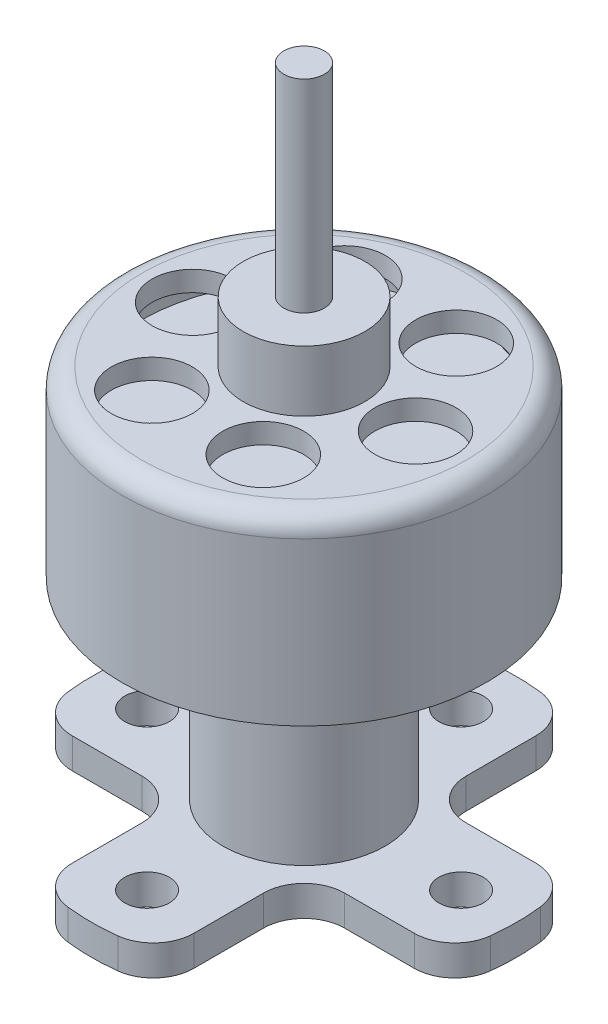
from build123d import *

# Parameters (mm, degrees)
BOSS_EXTRUDE1_DEPTH = 1.5
SKETCH2_R           = 1.1
CUT_EXTRUDE1_DEPTH  = 15.924811557
FILLET1_R           = 2
SKETCH3_R           = 4
BOSS_EXTRUDE2_DEPTH = 9.5
SKETCH4_R           = 9
BOSS_EXTRUDE3_DEPTH = 9
FILLET2_R           = 1
SKETCH5_R           = 3
BOSS_EXTRUDE4_DEPTH = 3
SKETCH6_R           = 1
BOSS_EXTRUDE5_DEPTH = 10
SKETCH7_R           = 2
CUT_EXTRUDE2_DEPTH  = 1
SKETCH8_R           = 8
CUT_EXTRUDE3_DEPTH  = 1


with BuildPart() as part:
    # Sketch1 → Boss-Extrude1 (new body)
    with BuildSketch(Plane(origin=(0, 0, 0), x_dir=(1, 0, 0), z_dir=(0, 1, 0))):
        with BuildLine():
            Line((-3, 10.062305899), (-3, 3))
            Line((-3, 3), (-10.062305899, 3))
            ThreePointArc((-10.062305899, 3), (-10.5, 0), (-10.062305899, -3))
            Line((-10.062305899, -3), (-3, -3))
            Line((-3, -3), (-3, -10.062305899))
            ThreePointArc((-3, -10.062305899), (0, -10.5), (3, -10.062305899))
            Line((3, -10.062305899), (3, -3))
            Line((3, -3), (10.062305899, -3))
            ThreePointArc((10.062305899, -3), (10.5, 0), (10.062305899, 3))
            Line((10.062305899, 3), (3, 3))
            Line((3, 3), (3, 10.062305899))
            ThreePointArc((3, 10.062305899), (0, 10.5), (-3, 10.062305899))
        make_face()
    extrude(amount=BOSS_EXTRUDE1_DEPTH)

    # Sketch2 → Cut-Extrude1 (cut, through all)
    with BuildSketch(Plane(origin=(0, 1.5, 0), x_dir=(1, 0, 0), z_dir=(0, 1, 0))):
        with Locations(Location((-7.75, 0, 0), (0, 0, 270))):
            Circle(SKETCH2_R)
        with Locations(Location((0, 7.75, 0), (0, 0, 270))):
            Circle(SKETCH2_R)
        with Locations(Location((7.75, 0, 0), (0, 0, 270))):
            Circle(SKETCH2_R)
        with Locations(Location((0, -7.75, 0), (0, 0, 270))):
            Circle(SKETCH2_R)
    extrude(amount=-CUT_EXTRUDE1_DEPTH, mode=Mode.SUBTRACT)

    # Fillet1
    fillet1_edges = [part.edges().sort_by_distance(p)[0] for p in [
        (3, 0.75, 3),
        (3, 0.75, 10.062305899),
        (-3, 0.75, 10.062305899),
        (-3, 0.75, 3),
        (-10.062305899, 0.75, 3),
        (-10.062305899, 0.75, -3),
        (-3, 0.75, -3),
        (-3, 0.75, -10.062305899),
        (3, 0.75, -10.062305899),
        (3, 0.75, -3),
        (10.062305899, 0.75, -3),
        (10.062305899, 0.75, 3),
    ]]
    fillet(fillet1_edges, radius=FILLET1_R)

    # Sketch3 → Boss-Extrude2 (add)
    with BuildSketch(Plane(origin=(0, 1.5, 0), x_dir=(1, 0, 0), z_dir=(0, 1, 0))):
        with Locations(Location((0, 0, 0), (0, 0, 270))):
            Circle(SKETCH3_R)
    extrude(amount=BOSS_EXTRUDE2_DEPTH)

    # Sketch4 → Boss-Extrude3 (add)
    with BuildSketch(Plane(origin=(0, 11, 0), x_dir=(1, 0, 0), z_dir=(0, 1, 0))):
        with Locations(Location((0, 0, 0), (0, 0, 270))):
            Circle(SKETCH4_R)
    extrude(amount=BOSS_EXTRUDE3_DEPTH)

    # Fillet2
    fillet2_edges = [part.edges().sort_by_distance(p)[0] for p in [
        (0, 20, -9),
    ]]
    fillet(fillet2_edges, radius=FILLET2_R)

    # Sketch5 → Boss-Extrude4 (add)
    with BuildSketch(Plane(origin=(0, 20, 0), x_dir=(1, 0, 0), z_dir=(0, 1, 0))):
        with Locations(Location((0, 0, 0), (0, 0, 270))):
            Circle(SKETCH5_R)
    extrude(amount=BOSS_EXTRUDE4_DEPTH)

    # Sketch6 → Boss-Extrude5 (add)
    with BuildSketch(Plane(origin=(0, 23, 0), x_dir=(1, 0, 0), z_dir=(0, 1, 0))):
        with Locations(Location((0, 0, 0), (0, 0, 270))):
            Circle(SKETCH6_R)
    extrude(amount=BOSS_EXTRUDE5_DEPTH)

    # Sketch7 → Cut-Extrude2 (cut)
    with BuildSketch(Plane(origin=(0, 20, 0), x_dir=(1, 0, 0), z_dir=(0, 1, 0))):
        with Locations(Location((-5.5, 0, 0), (0, 0, 270))):
            Circle(SKETCH7_R)
        with Locations(Location((-2.75, 4.763139721, 0), (0, 0, 270))):
            Circle(SKETCH7_R)
        with Locations(Location((2.75, 4.763139721, 0), (0, 0, 270))):
            Circle(SKETCH7_R)
        with Locations(Location((5.5, 0, 0), (0, 0, 270))):
            Circle(SKETCH7_R)
        with Locations(Location((2.75, -4.763139721, 0), (0, 0, 270))):
            Circle(SKETCH7_R)
        with Locations(Location((-2.75, -4.763139721, 0), (0, 0, 270))):
            Circle(SKETCH7_R)
    extrude(amount=-CUT_EXTRUDE2_DEPTH, mode=Mode.SUBTRACT)

    # Sketch8 → Cut-Extrude3 (cut)
    with BuildSketch(Plane(origin=(0, 19, 0), x_dir=(1, 0, 0), z_dir=(0, 1, 0))):
        with Locations(Location((0, 0, 0), (0, 0, 270))):
            Circle(SKETCH8_R)
    extrude(amount=-CUT_EXTRUDE3_DEPTH, mode=Mode.SUBTRACT)


solid = part.part
